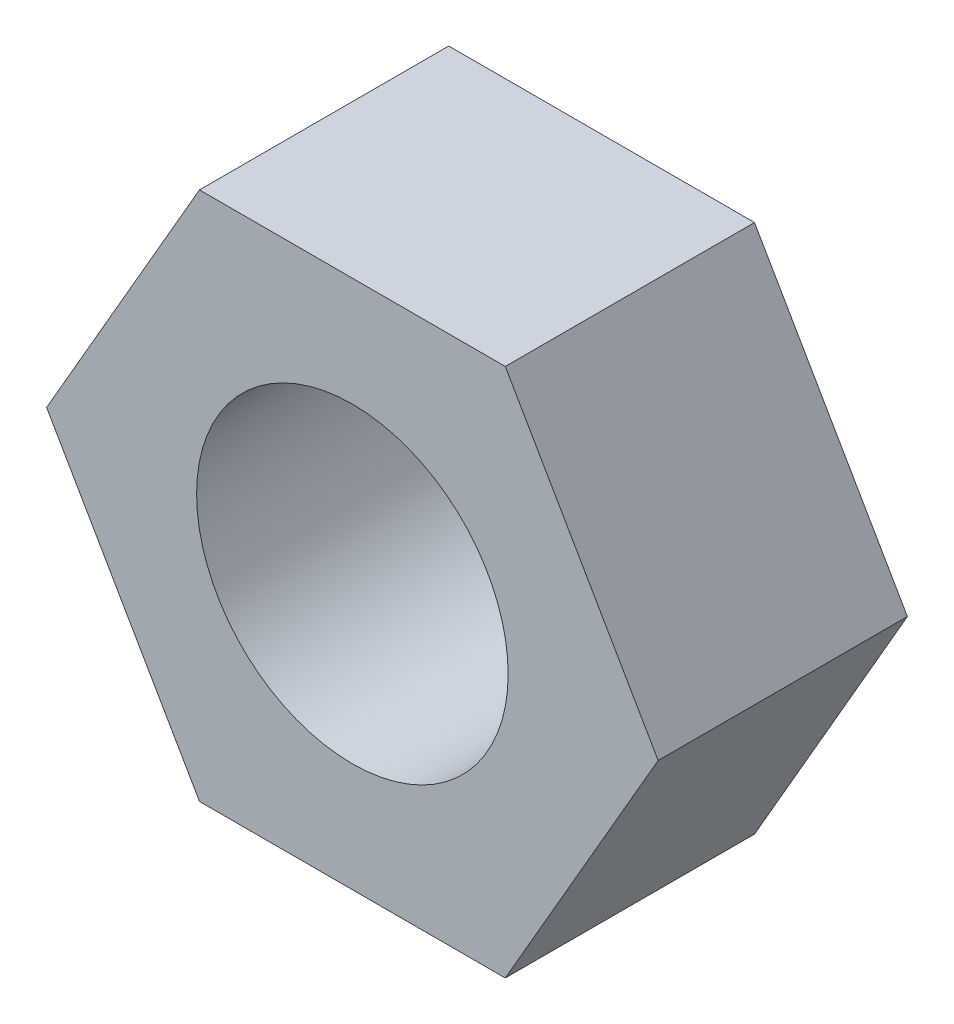
from build123d import *

# Parameters (mm, degrees)
BOSS_EXTRUDE1_DEPTH = 8
SKETCH2_R           = 5
CUT_EXTRUDE1_DEPTH  = 10


with BuildPart() as part:
    # Sketch1 → Boss-Extrude1 (new body)
    with BuildSketch(Plane.XY):
        Polygon((-9.814954576, 0), (-4.907477288, -8.5), (4.907477288, -8.5), (9.814954576, 0), (4.907477288, 8.5), (-4.907477288, 8.5), align=None)
    extrude(amount=BOSS_EXTRUDE1_DEPTH)

    # Sketch2 → Cut-Extrude1 (cut)
    with BuildSketch(Plane.XY.offset(8)):
        Circle(SKETCH2_R)
    extrude(amount=-CUT_EXTRUDE1_DEPTH, mode=Mode.SUBTRACT)


solid = part.part
